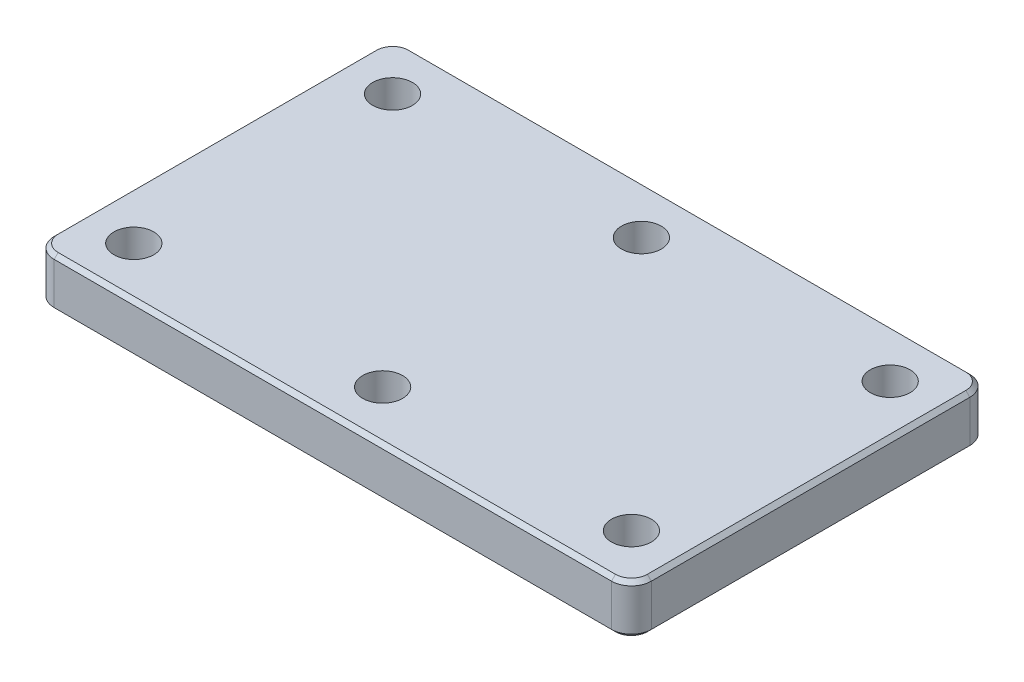
from build123d import *

# Parameters (mm, degrees)
SKETCH1_R           = 10
BOSS_EXTRUDE1_DEPTH = 12.5
CHAMFER1_SIZE       = 2


with BuildPart() as part:
    # Sketch1 → Boss-Extrude1 (new, symmetric)
    with BuildSketch(Plane(origin=(0, 0, 0), x_dir=(1, 0, 0), z_dir=(0, 1, 0))):
        with BuildLine():
            Line((10, 0), (290, 0))
            ThreePointArc((290, 0), (297.071067812, -2.928932188), (300, -10))
            Line((300, -10), (300, -170))
            ThreePointArc((300, -170), (297.071067812, -177.071067812), (290, -180))
            Line((290, -180), (10, -180))
            ThreePointArc((10, -180), (2.928932188, -177.071067812), (0, -170))
            Line((0, -170), (0, -10))
            ThreePointArc((0, -10), (2.928932188, -2.928932188), (10, 0))
        make_face()
        with Locations(Location((25, -25, 0), (0, 0, 270))):
            Circle(SKETCH1_R, mode=Mode.SUBTRACT)
        with Locations(Location((25, -155, 0), (0, 0, 270))):
            Circle(SKETCH1_R, mode=Mode.SUBTRACT)
        with Locations(Location((275, -25, 0), (0, 0, 270))):
            Circle(SKETCH1_R, mode=Mode.SUBTRACT)
        with Locations(Location((275, -155, 0), (0, 0, 270))):
            Circle(SKETCH1_R, mode=Mode.SUBTRACT)
        with Locations(Location((150, -25, 0), (0, 0, 270))):
            Circle(SKETCH1_R, mode=Mode.SUBTRACT)
        with Locations(Location((150, -155, 0), (0, 0, 270))):
            Circle(SKETCH1_R, mode=Mode.SUBTRACT)
    extrude(amount=BOSS_EXTRUDE1_DEPTH, both=True)

    # Chamfer1
    chamfer1_edges = [part.edges().sort_by_distance(p)[0] for p in [
        (150, -12.5, 0),
        (297.071067812, -12.5, 2.928932188),
        (300, -12.5, 90),
        (297.071067812, -12.5, 177.071067812),
        (297.071067812, 12.5, 2.928932188),
        (150, 12.5, 0),
        (2.928932188, 12.5, 2.928932188),
        (0, 12.5, 90),
        (2.928932188, 12.5, 177.071067812),
        (150, 12.5, 180),
        (297.071067812, 12.5, 177.071067812),
        (150, -12.5, 180),
        (300, 12.5, 90),
        (2.928932188, -12.5, 177.071067812),
        (0, -12.5, 90),
        (2.928932188, -12.5, 2.928932188),
    ]]
    chamfer(chamfer1_edges, length=CHAMFER1_SIZE)


solid = part.part
